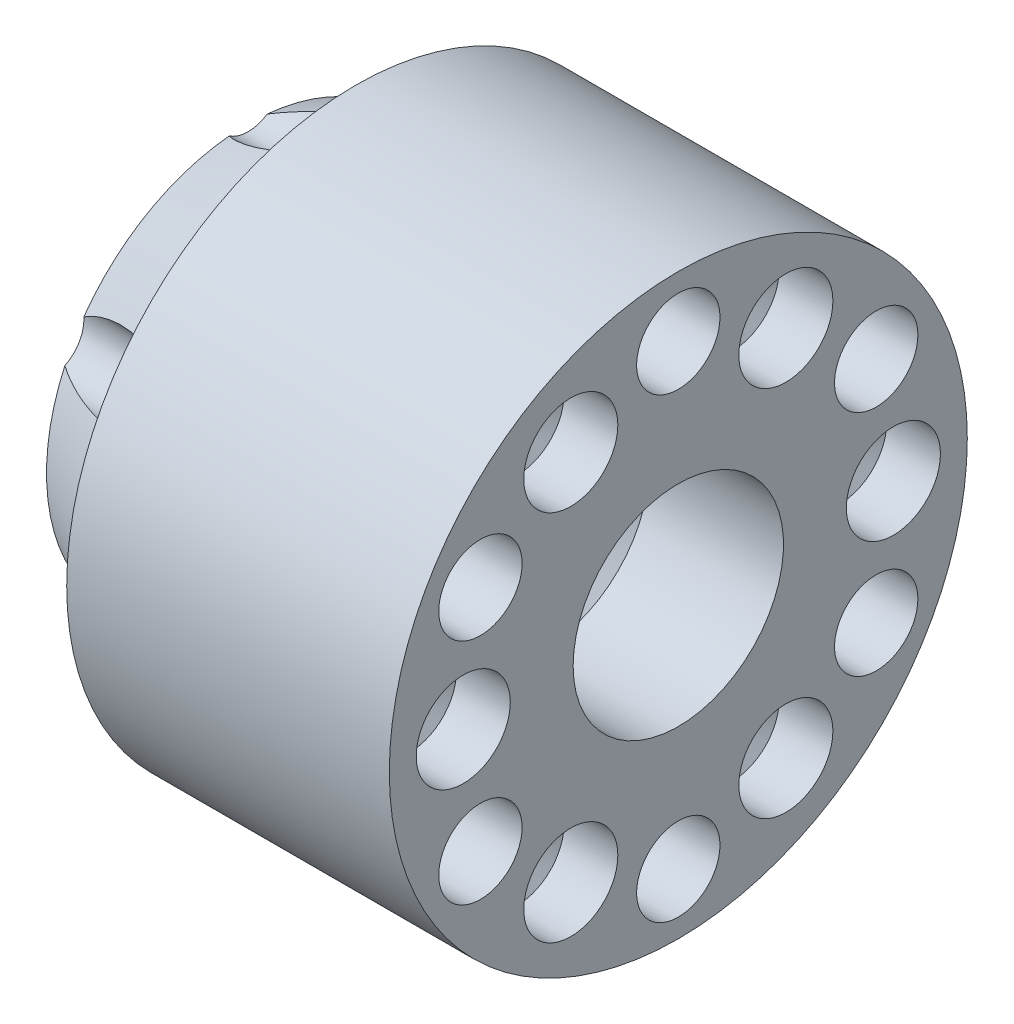
from build123d import *

# Parameters (mm, degrees)
SKETCH11_R                   = 3.1
EXTRUDE1_DEPTH               = 12
M6_TAPPED_HOLE1_D            = 5
M6_TAPPED_HOLE1_DEPTH        = 35
M6_TAPPED_HOLE1_TIP          = 1.502151548
F_7_0_7_DIAMETER_HOLE1_D     = 7
F_7_0_7_DIAMETER_HOLE1_DEPTH = 4
F_7_0_7_DIAMETER_HOLE1_TIP   = 2.103012167
EXTRUDE3_DEPTH               = 1


with BuildPart() as part:
    # Sketch1 → Revolve1 (revolve)
    with BuildSketch(Plane.XY, mode=Mode.PRIVATE) as revolve1_sk:
        Polygon((8, 18.5), (0, 15), (0, 8.5675), (20.675, 6.5), (22, 7.825), (32, 7.825), (32, 21.5), (8, 21.5), align=None)
    revolve(revolve1_sk.sketch.rotate(Axis((0, 0, 0), (1, 0, 0)), 90), axis=Axis((0, 0, 0), (1, 0, 0)))

    # Sketch11 → Extrude1 (cut)
    with BuildSketch(Plane(origin=(32, 0, 0), x_dir=(0, 0, -1), z_dir=(1, 0, 0))):
        with Locations((0, -17)):
            Circle(SKETCH11_R)
        with Locations((-14.722431864, -8.5)):
            Circle(SKETCH11_R)
        with Locations((-14.722431864, 8.5)):
            Circle(SKETCH11_R)
        with Locations((0, 17)):
            Circle(SKETCH11_R)
        with Locations((14.722431864, 8.5)):
            Circle(SKETCH11_R)
        with Locations((14.722431864, -8.5)):
            Circle(SKETCH11_R)
    extrude(amount=-EXTRUDE1_DEPTH, mode=Mode.SUBTRACT)

    # M6 Tapped Hole1
    with Locations(Plane(origin=(20, -17, 0), x_dir=(0, 0, 1), z_dir=(1, 0, 0))):
        with Locations((0, 0), (14.722431864, -8.5), (14.722431864, -25.5), (0, -34), (-14.722431864, -25.5), (-14.722431864, -8.5)):
            Hole(M6_TAPPED_HOLE1_D / 2, depth=M6_TAPPED_HOLE1_DEPTH)
            with Locations((0, 0, -(M6_TAPPED_HOLE1_DEPTH + M6_TAPPED_HOLE1_TIP / 2))):  # 118° drill point
                Cone(0, M6_TAPPED_HOLE1_D / 2, M6_TAPPED_HOLE1_TIP, mode=Mode.SUBTRACT)

    # Ø7.0 (7) Diameter Hole1
    with Locations(Plane(origin=(32, -13.856406461, -8), x_dir=(0, 0, 1), z_dir=(1, 0, 0))):
        with Locations((0, 0), (16, 0), (24, -13.856406461), (16, -27.712812922), (0, -27.712812922), (-8, -13.856406461)):
            Hole(F_7_0_7_DIAMETER_HOLE1_D / 2, depth=F_7_0_7_DIAMETER_HOLE1_DEPTH)
            with Locations((0, 0, -(F_7_0_7_DIAMETER_HOLE1_DEPTH + F_7_0_7_DIAMETER_HOLE1_TIP / 2))):  # 118° drill point
                Cone(0, F_7_0_7_DIAMETER_HOLE1_D / 2, F_7_0_7_DIAMETER_HOLE1_TIP, mode=Mode.SUBTRACT)

    # Sketch18 → Extrude3 (cut, symmetric)
    with BuildSketch(Plane.XY):
        Polygon((23.570558224, 5.305955372), (-1.084590537, 7.771470248), (-0.78607938, 10.756581818), (23.869069381, 8.291066942), align=None)
    extrude(amount=EXTRUDE3_DEPTH, both=True, mode=Mode.SUBTRACT)


solid = part.part
